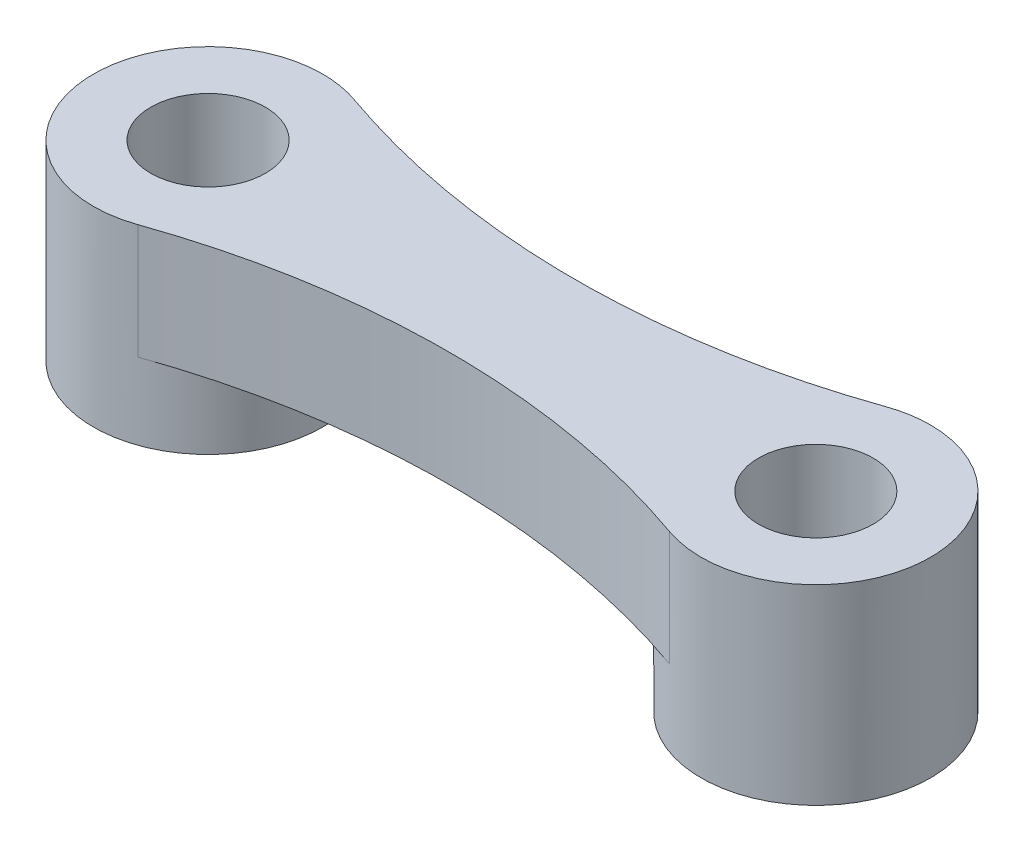
from build123d import *

# Parameters (mm, degrees)
EXTRUDE_1_DEPTH          = 3
EXTRUDE_START            = 2
SKETCH_2_R               = 3
EXTRUDE_2_DEPTH          = 2
SKETCH_3_R               = 3
EXTRUDE_3_DEPTH          = 2
F_3_0_3_DIAMETER_HOLE1_D = 3


with BuildPart() as part:
    # 草图1 → 凸台-拉伸1 (new body)
    with BuildSketch(Plane.XZ):
        with BuildLine():
            ThreePointArc((-6.95625, -2.830629071), (0, -1.645032568), (6.95625, -2.830629071))
            ThreePointArc((6.95625, -2.830629071), (10.95, 0), (6.95625, 2.830629071))
            ThreePointArc((6.95625, 2.830629071), (0, 1.645032568), (-6.95625, 2.830629071))
            ThreePointArc((-6.95625, 2.830629071), (-10.95, 0), (-6.95625, -2.830629071))
        make_face()
    extrude(amount=-EXTRUDE_1_DEPTH)

    # 草图2 → 凸台-拉伸2 (add)
    with BuildSketch(Plane.XZ.offset(EXTRUDE_START)):
        with Locations(Location((7.95, 0, 0), (0, 0, 269.999999998))):
            Circle(SKETCH_2_R)
    extrude(amount=-EXTRUDE_2_DEPTH)

    # 草图3 → 凸台-拉伸3 (add)
    with BuildSketch(Plane.XZ.offset(EXTRUDE_START)):
        with Locations(Location((-7.95, 0, 0), (0, 0, 270))):
            Circle(SKETCH_3_R)
    extrude(amount=-EXTRUDE_3_DEPTH)

    # Ø3.0 (3) Diameter Hole1 (through all)
    with Locations(Plane(origin=(0, 3, 0), x_dir=(1, 0, 0), z_dir=(0, 1, 0))):
        with Locations((-7.95, 0), (7.95, 0)):
            Hole(F_3_0_3_DIAMETER_HOLE1_D / 2)


solid = part.part
